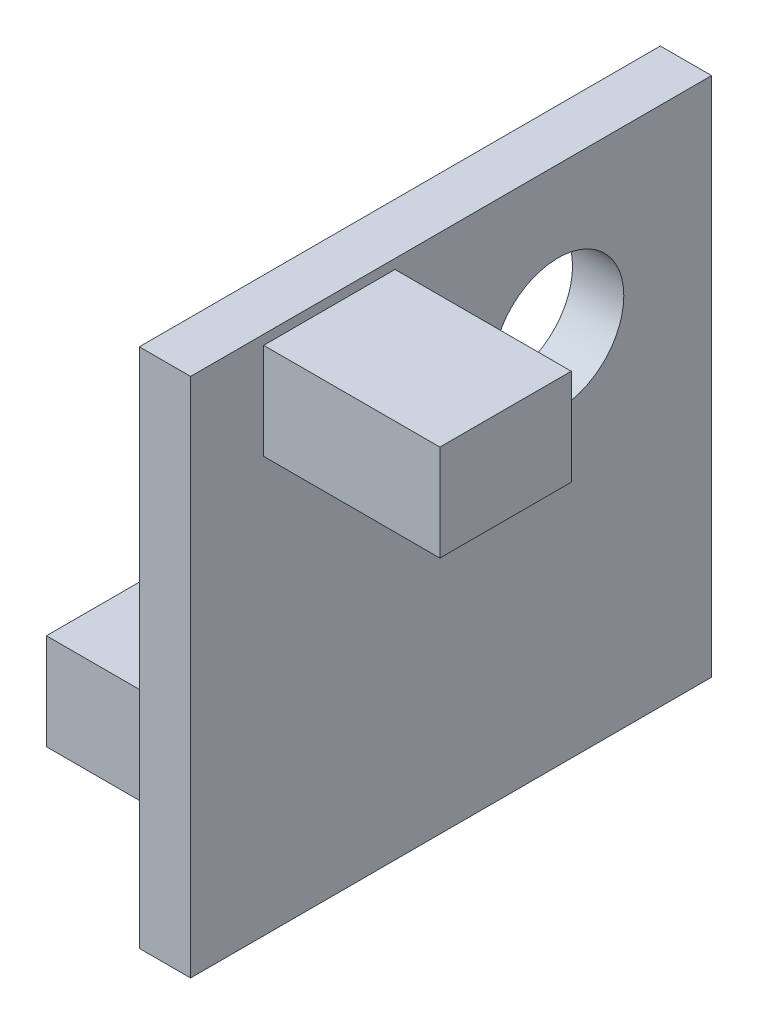
from build123d import *

# Parameters (mm, degrees)
SKETCH1_W           = 16.26
SKETCH1_H           = 16.26
BOSS_EXTRUDE1_DEPTH = 1.6
SKETCH1_3_W         = 4.1
SKETCH1_3_H         = 3
BOSS_EXTRUDE2_DEPTH = 7.1
SKETCH2_R           = 2.05
CUT_EXTRUDE1_DEPTH  = 24.643713752
SKETCH3_W           = 7.5
SKETCH3_H           = 3
BOSS_EXTRUDE3_DEPTH = 6.5


with BuildPart() as part:
    # Sketch1 → Boss-Extrude1 (new body)
    with BuildSketch(Plane(origin=(0, 0, 0), x_dir=(0, 0, -1), z_dir=(1, 0, 0))):
        with Locations((8.13, -8.13)):
            Rectangle(SKETCH1_W, SKETCH1_H)
    extrude(amount=BOSS_EXTRUDE1_DEPTH)

    # Sketch1<3> → Boss-Extrude2 (add)
    with BuildSketch(Plane(origin=(0, 0, 0), x_dir=(0, 0, -1), z_dir=(1, 0, 0))):
        with Locations((4.33, -1.8)):
            Rectangle(SKETCH1_3_W, SKETCH1_3_H)
    extrude(amount=BOSS_EXTRUDE2_DEPTH)

    # Sketch2 → Cut-Extrude1 (cut, through all)
    with BuildSketch(Plane(origin=(1.6, 0, 0), x_dir=(0, 0, -1), z_dir=(1, 0, 0))):
        with Locations((11.47, -4.58)):
            Circle(SKETCH2_R)
    extrude(amount=-CUT_EXTRUDE1_DEPTH, mode=Mode.SUBTRACT)

    # Sketch3 → Boss-Extrude3 (add)
    with BuildSketch(Plane(origin=(1.6, 0, 0), x_dir=(0, 0, -1), z_dir=(1, 0, 0))):
        with Locations((5.75, -12.76)):
            Rectangle(SKETCH3_W, SKETCH3_H)
    extrude(amount=-BOSS_EXTRUDE3_DEPTH)


solid = part.part
